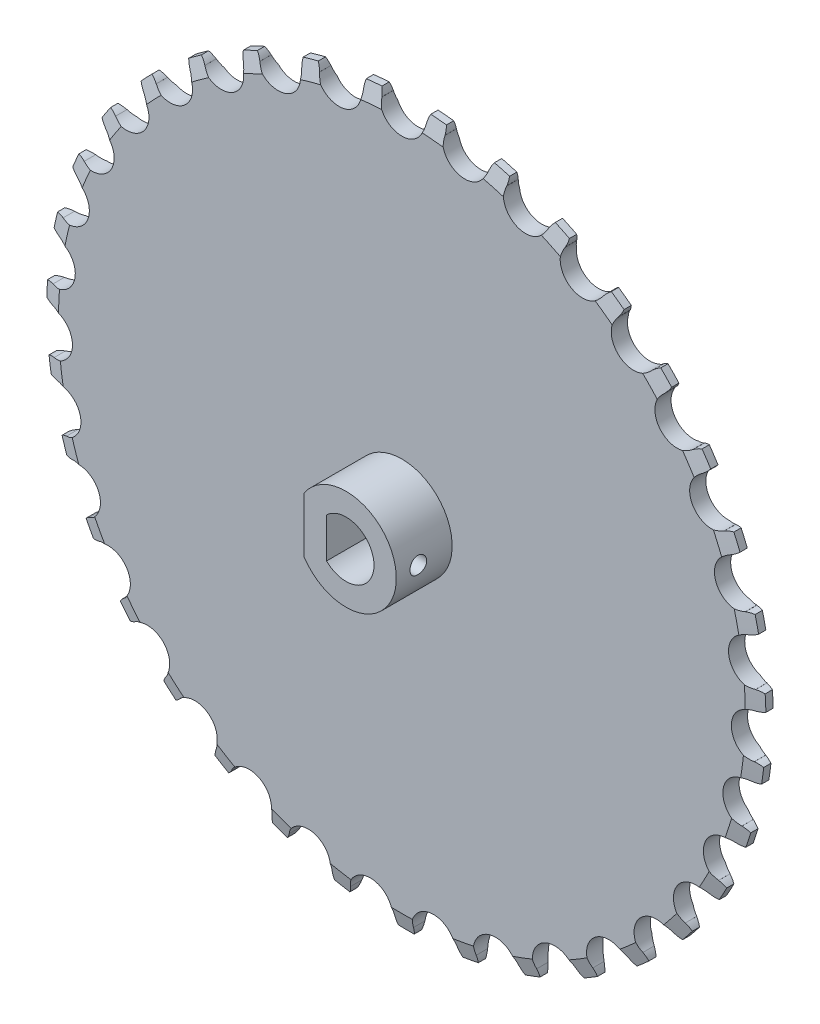
from build123d import *

# Parameters (mm, degrees)
EXTRUDE_THIN1_DEPTH = 10
SKETCH11_R          = 1.5
CUT_EXTRUDE5_DEPTH  = 97.463143506
CUT_EXTRUDE15_DEPTH = 97.463143539
CIRPATTERN2_COUNT   = 35
CUT_EXTRUDE16_DEPTH = 92.613147773


with BuildPart() as part:
    # Sketch3 → Revolve1 (revolve)
    with BuildSketch(Plane(origin=(0, 0, 0), x_dir=(0, 0, -1), z_dir=(1, 0, 0)), mode=Mode.PRIVATE) as revolve1_sk:
        Polygon((-21.780018948, 0), (-18.880018948, 0), (-18.880018948, 61.5), (-19.680018948, 64.401740857), (-20.980018948, 64.401740857), (-21.780018948, 61.5), align=None)
    revolve(revolve1_sk.sketch.rotate(Axis((0, 0, 59.998548482), (0, 0, -1)), 90), axis=Axis((0, 0, 59.998548482), (0, 0, -1)))

    # Sketch7 → Extrude-Thin1 (add)
    with BuildSketch(Plane.XY.offset(21.780018948)):
        with BuildLine():
            Line((-7.498179116, 4.977681181), (-7.498179116, -4.977681181))
            ThreePointArc((-7.498179116, -4.977681181), (9, 0), (-7.498179116, 4.977681181))
        make_face()
        with BuildLine():
            Line((-3.498179116, 3.572498127), (-3.498179116, -3.572498127))
            ThreePointArc((-3.498179116, -3.572498127), (5, 0), (-3.498179116, 3.572498127))
        make_face(mode=Mode.SUBTRACT)
    extrude(amount=EXTRUDE_THIN1_DEPTH)

    # Sketch11 → Cut-Extrude5 (cut, through all)
    with BuildSketch(Plane(origin=(0, 0, 0), x_dir=(0, 0, -1), z_dir=(1, 0, 0))):
        with Locations(Location((-27.831305726, 0, 0), (0, 0, 180))):
            Circle(SKETCH11_R)
    extrude(amount=CUT_EXTRUDE5_DEPTH, mode=Mode.SUBTRACT)

    # Sketch14 → Cut-Extrude15 (cut, through all)
    with BuildSketch(Plane.XY):
        with BuildLine():
            Line((-132.328738023, 337.545668032), (-4.370229728, 64.253290324))
            ThreePointArc((-4.370229728, 64.253290324), (-4.134156115, 63.611076057), (-4.010989265, 62.938023426))
            ThreePointArc((-4.010989265, 62.938023426), (-4.004488689, 62.938437366), (-3.997988071, 62.938850634))
            ThreePointArc((-3.997988071, 62.938850634), (0, 59.065702467), (3.997988071, 62.938850634))
            ThreePointArc((3.997988071, 62.938850634), (4.004488689, 62.938437366), (4.010989265, 62.938023426))
            ThreePointArc((4.010989265, 62.938023426), (4.134156115, 63.611076057), (4.370229728, 64.253290324))
            Line((4.370229728, 64.253290324), (132.328738023, 337.545668032))
            Line((132.328738023, 337.545668032), (132.328738023, 941.075629372))
            Line((132.328738023, 941.075629372), (-132.328738023, 941.075629372))
            Line((-132.328738023, 941.075629372), (-132.328738023, 337.545668032))
        make_face()
    cut_extrude15 = extrude(amount=CUT_EXTRUDE15_DEPTH, mode=Mode.SUBTRACT)

    # CirPattern2: Cut-Extrude15 ×35 about axis
    cirpattern2_axis = Axis((0, 0, 19.680018948), (0, 0, 1))
    for i in range(1, CIRPATTERN2_COUNT):
        add(cut_extrude15.rotate(cirpattern2_axis, i * 360 / CIRPATTERN2_COUNT), mode=Mode.SUBTRACT)

    # Sketch17 → Cut-Extrude16 (cut, through all)
    with BuildSketch(Plane.XY.offset(21.780018948)):
        with BuildLine():
            Line((-3.498179116, 3.572498127), (-3.498179116, -3.572498127))
            ThreePointArc((-3.498179116, -3.572498127), (5, 0), (-3.498179116, 3.572498127))
        make_face()
    extrude(amount=-CUT_EXTRUDE16_DEPTH, mode=Mode.SUBTRACT)


solid = part.part
